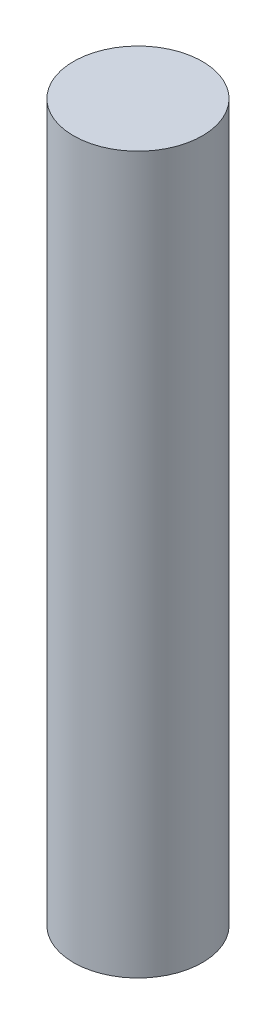
from build123d import *

# Parameters (mm, degrees)
SKETCH1_R           = 4.5
BOSS_EXTRUDE1_DEPTH = 50


with BuildPart() as part:
    # Sketch1 → Boss-Extrude1 (new body)
    with BuildSketch(Plane(origin=(0, 0, 0), x_dir=(1, 0, 0), z_dir=(0, 1, 0))):
        with Locations(Location((0, 0, 0), (0, 0, 270))):
            Circle(SKETCH1_R)
    extrude(amount=BOSS_EXTRUDE1_DEPTH)


solid = part.part
